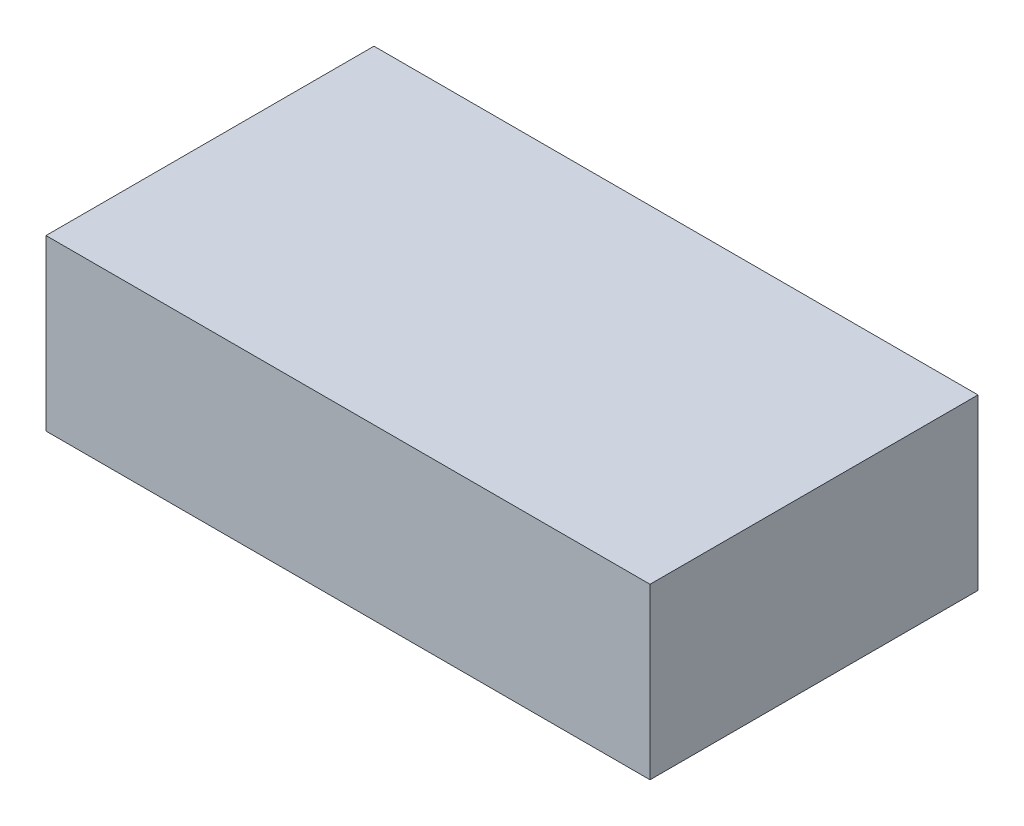
from build123d import *

# Parameters (mm, degrees)
ESQUISSE1_W        = 76.43
ESQUISSE1_H        = 41.5
BOSS_EXTRU_1_DEPTH = 21.43


with BuildPart() as part:
    # Esquisse1 → Boss.-Extru.1 (new body)
    with BuildSketch(Plane(origin=(0, 0, 0), x_dir=(1, 0, 0), z_dir=(0, 1, 0))):
        with Locations((0, 20.75)):
            Rectangle(ESQUISSE1_W, ESQUISSE1_H)
    extrude(amount=BOSS_EXTRU_1_DEPTH)


solid = part.part
